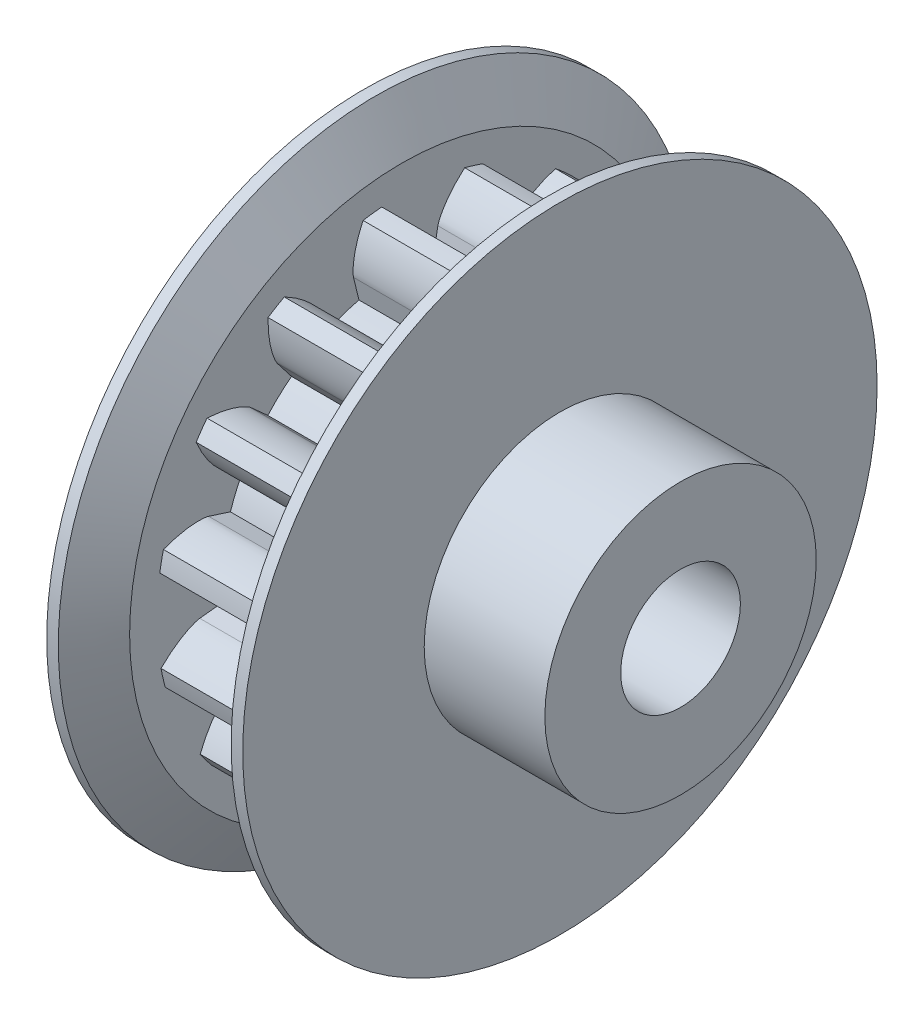
from build123d import *

# Parameters (mm, degrees)
SKETCH1_R                 = 8.116902098
BOSS_EXTRUDE1_DEPTH       = 4
CUT_EXTRUDE1_DEPTH        = 13.155994378
CIRPATTERN6_COUNT         = 15
CIRPATTERN6_COPY_1_DEPTH  = 13.155994378
CIRPATTERN6_COPY_2_DEPTH  = 13.155994378
CIRPATTERN6_COPY_3_DEPTH  = 13.155994378
CIRPATTERN6_COPY_4_DEPTH  = 13.155994378
CIRPATTERN6_COPY_5_DEPTH  = 13.155994378
CIRPATTERN6_COPY_6_DEPTH  = 13.155994378
CIRPATTERN6_COPY_7_DEPTH  = 13.155994378
CIRPATTERN6_COPY_8_DEPTH  = 13.155994378
CIRPATTERN6_COPY_9_DEPTH  = 13.155994378
CIRPATTERN6_COPY_10_DEPTH = 13.155994378
CIRPATTERN6_COPY_11_DEPTH = 13.155994378
CIRPATTERN6_COPY_12_DEPTH = 13.155994378
CIRPATTERN6_COPY_13_DEPTH = 13.155994378
CIRPATTERN6_COPY_14_DEPTH = 13.155994378
SKETCH5_R                 = 4.5
BOSS_EXTRUDE2_DEPTH       = 4
SKETCH6_R                 = 1.984375
CUT_EXTRUDE2_DEPTH        = 19.207820136


with BuildPart() as part:
    # Sketch1 → Boss-Extrude1 (new body)
    with BuildSketch(Plane.YZ):
        with Locations(Location((0, 0, 0), (0, 0, 270))):
            Circle(SKETCH1_R)
    extrude(amount=BOSS_EXTRUDE1_DEPTH)

    # Sketch3 → Cut-Extrude1 (cut, through all)
    with BuildSketch(Plane.YZ.offset(4)):
        with BuildLine():
            Line((7.133104785, -0.642390333), (6.70292593, -0.603649456))
            Line((6.70292593, -0.603649456), (5.944253988, -0.535325278))
            ThreePointArc((5.944253988, -0.535325278), (5.962293238, -0.267932763), (5.968310366, 0))
            Line((5.968310366, 0), (6.730052651, 0))
            add(Edge.make_bspline(
                [(6.730052651, 0), (6.735028201, 0.000105291), (6.748972525, 0.000726446), (6.77527671, 0.003186858), (6.818021267, 0.009021853), (6.872154257, 0.019121147), (6.9416096, 0.03521433), (7.022648863, 0.058053596), (7.110734403, 0.087182224), (7.205358415, 0.123170438), (7.298569457, 0.162835205), (7.390333265, 0.205857711), (7.480573489, 0.251804665), (7.588384326, 0.311053922), (7.715499791, 0.387065097), (7.860631857, 0.482971281), (8.020934099, 0.599954491), (8.179305123, 0.727671007), (8.330895439, 0.860239842), (8.478803786, 1.001795462), (8.618157696, 1.144139991), (8.757082001, 1.299382167), (8.88238288, 1.446480246), (9.015933814, 1.619048793), (9.121746557, 1.760623063), (9.225109986, 1.913051571), (9.274529275, 1.988136308), (9.299406998, 2.026881066)],
                knots=[0, 0, 0, 0, 0, 0.005376748, 0.015083688, 0.02853182, 0.046610139, 0.064854849, 0.092110525, 0.119476175, 0.146842495, 0.174208853, 0.201574955, 0.228941013, 0.256307345, 0.307035032, 0.361767351, 0.41649966, 0.471231936, 0.525964281, 0.580696615, 0.635428982, 0.690161387, 0.744893688, 0.799626083, 0.854358408, 0.909090916, 0.909090916, 0.909090916, 0.909090916, 0.909090916], degree=4))
            Line((9.299406998, 2.026881066), (9.299406998, -0.837482322))
            Line((9.299406998, -0.837482322), (7.133104785, -0.642390333))
        make_face()
    cut_extrude1 = extrude(amount=-CUT_EXTRUDE1_DEPTH, mode=Mode.SUBTRACT)

    # Mirror1: Cut-Extrude1 across plane
    add(cut_extrude1.mirror(Plane(origin=(0, 7.133104785, -0.642390333), x_dir=(1, 0, 0), z_dir=(0, -0.08969461116093967, -0.9959693151541809))), mode=Mode.SUBTRACT)

    # CirPattern6: Cut-Extrude1 ×15 about axis
    cirpattern6_axis = Axis((4, 0, 0), (-1, 0, 0))
    for i in range(1, CIRPATTERN6_COUNT):
        add(cut_extrude1.rotate(cirpattern6_axis, i * 360 / CIRPATTERN6_COUNT), mode=Mode.SUBTRACT)

    # CirPattern6 copy 1 sketch → CirPattern6 copy 1 (cut, through all)
    with BuildSketch(Plane(origin=(4, 0, 0), x_dir=(0, 0.8261762114847315, -0.5634118099372218), z_dir=(1, 0, 0))):
        with BuildLine():
            Line((7.133104785, 0.642390333), (6.70292593, 0.603649456))
            Line((6.70292593, 0.603649456), (5.944253988, 0.535325278))
            ThreePointArc((5.944253988, 0.535325278), (5.962293238, 0.267932763), (5.968310366, 0))
            Line((5.968310366, 0), (6.730052651, 0))
            add(Edge.make_bspline(
                [(6.730052651, 0), (6.735028201, -0.000105291), (6.748972525, -0.000726446), (6.77527671, -0.003186858), (6.818021267, -0.009021853), (6.872154257, -0.019121147), (6.9416096, -0.03521433), (7.022648863, -0.058053596), (7.110734403, -0.087182224), (7.205358415, -0.123170438), (7.298569457, -0.162835205), (7.390333265, -0.205857711), (7.480573489, -0.251804665), (7.588384326, -0.311053922), (7.715499791, -0.387065097), (7.860631857, -0.482971281), (8.020934099, -0.599954491), (8.179305123, -0.727671007), (8.330895439, -0.860239842), (8.478803786, -1.001795462), (8.618157696, -1.144139991), (8.757082001, -1.299382167), (8.88238288, -1.446480246), (9.015933814, -1.619048793), (9.121746557, -1.760623063), (9.225109986, -1.913051571), (9.274529275, -1.988136308), (9.299406998, -2.026881066)],
                knots=[0, 0, 0, 0, 0, 0.005376748, 0.015083688, 0.02853182, 0.046610139, 0.064854849, 0.092110525, 0.119476175, 0.146842495, 0.174208853, 0.201574955, 0.228941013, 0.256307345, 0.307035032, 0.361767351, 0.41649966, 0.471231936, 0.525964281, 0.580696615, 0.635428982, 0.690161387, 0.744893688, 0.799626083, 0.854358408, 0.909090916, 0.909090916, 0.909090916, 0.909090916, 0.909090916], degree=4))
            Line((9.299406998, -2.026881066), (9.299406998, 0.837482322))
            Line((9.299406998, 0.837482322), (7.133104785, 0.642390333))
        make_face()
    extrude(amount=-CIRPATTERN6_COPY_1_DEPTH, mode=Mode.SUBTRACT)

    # CirPattern6 copy 2 sketch → CirPattern6 copy 2 (cut, through all)
    with BuildSketch(Plane(origin=(4, 0, 0), x_dir=(0, 0.5255892969711229, -0.8507384385987274), z_dir=(1, 0, 0))):
        with BuildLine():
            Line((7.133104785, 0.642390333), (6.70292593, 0.603649456))
            Line((6.70292593, 0.603649456), (5.944253988, 0.535325278))
            ThreePointArc((5.944253988, 0.535325278), (5.962293238, 0.267932763), (5.968310366, 0))
            Line((5.968310366, 0), (6.730052651, 0))
            add(Edge.make_bspline(
                [(6.730052651, 0), (6.735028201, -0.000105291), (6.748972525, -0.000726446), (6.77527671, -0.003186858), (6.818021267, -0.009021853), (6.872154257, -0.019121147), (6.9416096, -0.03521433), (7.022648863, -0.058053596), (7.110734403, -0.087182224), (7.205358415, -0.123170438), (7.298569457, -0.162835205), (7.390333265, -0.205857711), (7.480573489, -0.251804665), (7.588384326, -0.311053922), (7.715499791, -0.387065097), (7.860631857, -0.482971281), (8.020934099, -0.599954491), (8.179305123, -0.727671007), (8.330895439, -0.860239842), (8.478803786, -1.001795462), (8.618157696, -1.144139991), (8.757082001, -1.299382167), (8.88238288, -1.446480246), (9.015933814, -1.619048793), (9.121746557, -1.760623063), (9.225109986, -1.913051571), (9.274529275, -1.988136308), (9.299406998, -2.026881066)],
                knots=[0, 0, 0, 0, 0, 0.005376748, 0.015083688, 0.02853182, 0.046610139, 0.064854849, 0.092110525, 0.119476175, 0.146842495, 0.174208853, 0.201574955, 0.228941013, 0.256307345, 0.307035032, 0.361767351, 0.41649966, 0.471231936, 0.525964281, 0.580696615, 0.635428982, 0.690161387, 0.744893688, 0.799626083, 0.854358408, 0.909090916, 0.909090916, 0.909090916, 0.909090916, 0.909090916], degree=4))
            Line((9.299406998, -2.026881066), (9.299406998, 0.837482322))
            Line((9.299406998, 0.837482322), (7.133104785, 0.642390333))
        make_face()
    extrude(amount=-CIRPATTERN6_COPY_2_DEPTH, mode=Mode.SUBTRACT)

    # CirPattern6 copy 3 sketch → CirPattern6 copy 3 (cut, through all)
    with BuildSketch(Plane(origin=(4, 0, 0), x_dir=(0, 0.1341232181823432, -0.9909646625104305), z_dir=(1, 0, 0))):
        with BuildLine():
            Line((7.133104785, 0.642390333), (6.70292593, 0.603649456))
            Line((6.70292593, 0.603649456), (5.944253988, 0.535325278))
            ThreePointArc((5.944253988, 0.535325278), (5.962293238, 0.267932763), (5.968310366, 0))
            Line((5.968310366, 0), (6.730052651, 0))
            add(Edge.make_bspline(
                [(6.730052651, 0), (6.735028201, -0.000105291), (6.748972525, -0.000726446), (6.77527671, -0.003186858), (6.818021267, -0.009021853), (6.872154257, -0.019121147), (6.9416096, -0.03521433), (7.022648863, -0.058053596), (7.110734403, -0.087182224), (7.205358415, -0.123170438), (7.298569457, -0.162835205), (7.390333265, -0.205857711), (7.480573489, -0.251804665), (7.588384326, -0.311053922), (7.715499791, -0.387065097), (7.860631857, -0.482971281), (8.020934099, -0.599954491), (8.179305123, -0.727671007), (8.330895439, -0.860239842), (8.478803786, -1.001795462), (8.618157696, -1.144139991), (8.757082001, -1.299382167), (8.88238288, -1.446480246), (9.015933814, -1.619048793), (9.121746557, -1.760623063), (9.225109986, -1.913051571), (9.274529275, -1.988136308), (9.299406998, -2.026881066)],
                knots=[0, 0, 0, 0, 0, 0.005376748, 0.015083688, 0.02853182, 0.046610139, 0.064854849, 0.092110525, 0.119476175, 0.146842495, 0.174208853, 0.201574955, 0.228941013, 0.256307345, 0.307035032, 0.361767351, 0.41649966, 0.471231936, 0.525964281, 0.580696615, 0.635428982, 0.690161387, 0.744893688, 0.799626083, 0.854358408, 0.909090916, 0.909090916, 0.909090916, 0.909090916, 0.909090916], degree=4))
            Line((9.299406998, -2.026881066), (9.299406998, 0.837482322))
            Line((9.299406998, 0.837482322), (7.133104785, 0.642390333))
        make_face()
    extrude(amount=-CIRPATTERN6_COPY_3_DEPTH, mode=Mode.SUBTRACT)

    # CirPattern6 copy 4 sketch → CirPattern6 copy 4 (cut, through all)
    with BuildSketch(Plane(origin=(4, 0, 0), x_dir=(0, -0.2805339835013487, -0.9598440936427461), z_dir=(1, 0, 0))):
        with BuildLine():
            Line((7.133104785, 0.642390333), (6.70292593, 0.603649456))
            Line((6.70292593, 0.603649456), (5.944253988, 0.535325278))
            ThreePointArc((5.944253988, 0.535325278), (5.962293238, 0.267932763), (5.968310366, 0))
            Line((5.968310366, 0), (6.730052651, 0))
            add(Edge.make_bspline(
                [(6.730052651, 0), (6.735028201, -0.000105291), (6.748972525, -0.000726446), (6.77527671, -0.003186858), (6.818021267, -0.009021853), (6.872154257, -0.019121147), (6.9416096, -0.03521433), (7.022648863, -0.058053596), (7.110734403, -0.087182224), (7.205358415, -0.123170438), (7.298569457, -0.162835205), (7.390333265, -0.205857711), (7.480573489, -0.251804665), (7.588384326, -0.311053922), (7.715499791, -0.387065097), (7.860631857, -0.482971281), (8.020934099, -0.599954491), (8.179305123, -0.727671007), (8.330895439, -0.860239842), (8.478803786, -1.001795462), (8.618157696, -1.144139991), (8.757082001, -1.299382167), (8.88238288, -1.446480246), (9.015933814, -1.619048793), (9.121746557, -1.760623063), (9.225109986, -1.913051571), (9.274529275, -1.988136308), (9.299406998, -2.026881066)],
                knots=[0, 0, 0, 0, 0, 0.005376748, 0.015083688, 0.02853182, 0.046610139, 0.064854849, 0.092110525, 0.119476175, 0.146842495, 0.174208853, 0.201574955, 0.228941013, 0.256307345, 0.307035032, 0.361767351, 0.41649966, 0.471231936, 0.525964281, 0.580696615, 0.635428982, 0.690161387, 0.744893688, 0.799626083, 0.854358408, 0.909090916, 0.909090916, 0.909090916, 0.909090916, 0.909090916], degree=4))
            Line((9.299406998, -2.026881066), (9.299406998, 0.837482322))
            Line((9.299406998, 0.837482322), (7.133104785, 0.642390333))
        make_face()
    extrude(amount=-CIRPATTERN6_COPY_4_DEPTH, mode=Mode.SUBTRACT)

    # CirPattern6 copy 5 sketch → CirPattern6 copy 5 (cut, through all)
    with BuildSketch(Plane(origin=(4, 0, 0), x_dir=(0, -0.6466843108664259, -0.7627577610743896), z_dir=(1, 0, 0))):
        with BuildLine():
            Line((7.133104785, 0.642390333), (6.70292593, 0.603649456))
            Line((6.70292593, 0.603649456), (5.944253988, 0.535325278))
            ThreePointArc((5.944253988, 0.535325278), (5.962293238, 0.267932763), (5.968310366, 0))
            Line((5.968310366, 0), (6.730052651, 0))
            add(Edge.make_bspline(
                [(6.730052651, 0), (6.735028201, -0.000105291), (6.748972525, -0.000726446), (6.77527671, -0.003186858), (6.818021267, -0.009021853), (6.872154257, -0.019121147), (6.9416096, -0.03521433), (7.022648863, -0.058053596), (7.110734403, -0.087182224), (7.205358415, -0.123170438), (7.298569457, -0.162835205), (7.390333265, -0.205857711), (7.480573489, -0.251804665), (7.588384326, -0.311053922), (7.715499791, -0.387065097), (7.860631857, -0.482971281), (8.020934099, -0.599954491), (8.179305123, -0.727671007), (8.330895439, -0.860239842), (8.478803786, -1.001795462), (8.618157696, -1.144139991), (8.757082001, -1.299382167), (8.88238288, -1.446480246), (9.015933814, -1.619048793), (9.121746557, -1.760623063), (9.225109986, -1.913051571), (9.274529275, -1.988136308), (9.299406998, -2.026881066)],
                knots=[0, 0, 0, 0, 0, 0.005376748, 0.015083688, 0.02853182, 0.046610139, 0.064854849, 0.092110525, 0.119476175, 0.146842495, 0.174208853, 0.201574955, 0.228941013, 0.256307345, 0.307035032, 0.361767351, 0.41649966, 0.471231936, 0.525964281, 0.580696615, 0.635428982, 0.690161387, 0.744893688, 0.799626083, 0.854358408, 0.909090916, 0.909090916, 0.909090916, 0.909090916, 0.909090916], degree=4))
            Line((9.299406998, -2.026881066), (9.299406998, 0.837482322))
            Line((9.299406998, 0.837482322), (7.133104785, 0.642390333))
        make_face()
    extrude(amount=-CIRPATTERN6_COPY_5_DEPTH, mode=Mode.SUBTRACT)

    # CirPattern6 copy 6 sketch → CirPattern6 copy 6 (cut, through all)
    with BuildSketch(Plane(origin=(4, 0, 0), x_dir=(0, -0.9010170459401696, -0.43378368217955166), z_dir=(1, 0, 0))):
        with BuildLine():
            Line((7.133104785, 0.642390333), (6.70292593, 0.603649456))
            Line((6.70292593, 0.603649456), (5.944253988, 0.535325278))
            ThreePointArc((5.944253988, 0.535325278), (5.962293238, 0.267932763), (5.968310366, 0))
            Line((5.968310366, 0), (6.730052651, 0))
            add(Edge.make_bspline(
                [(6.730052651, 0), (6.735028201, -0.000105291), (6.748972525, -0.000726446), (6.77527671, -0.003186858), (6.818021267, -0.009021853), (6.872154257, -0.019121147), (6.9416096, -0.03521433), (7.022648863, -0.058053596), (7.110734403, -0.087182224), (7.205358415, -0.123170438), (7.298569457, -0.162835205), (7.390333265, -0.205857711), (7.480573489, -0.251804665), (7.588384326, -0.311053922), (7.715499791, -0.387065097), (7.860631857, -0.482971281), (8.020934099, -0.599954491), (8.179305123, -0.727671007), (8.330895439, -0.860239842), (8.478803786, -1.001795462), (8.618157696, -1.144139991), (8.757082001, -1.299382167), (8.88238288, -1.446480246), (9.015933814, -1.619048793), (9.121746557, -1.760623063), (9.225109986, -1.913051571), (9.274529275, -1.988136308), (9.299406998, -2.026881066)],
                knots=[0, 0, 0, 0, 0, 0.005376748, 0.015083688, 0.02853182, 0.046610139, 0.064854849, 0.092110525, 0.119476175, 0.146842495, 0.174208853, 0.201574955, 0.228941013, 0.256307345, 0.307035032, 0.361767351, 0.41649966, 0.471231936, 0.525964281, 0.580696615, 0.635428982, 0.690161387, 0.744893688, 0.799626083, 0.854358408, 0.909090916, 0.909090916, 0.909090916, 0.909090916, 0.909090916], degree=4))
            Line((9.299406998, -2.026881066), (9.299406998, 0.837482322))
            Line((9.299406998, 0.837482322), (7.133104785, 0.642390333))
        make_face()
    extrude(amount=-CIRPATTERN6_COPY_6_DEPTH, mode=Mode.SUBTRACT)

    # CirPattern6 copy 7 sketch → CirPattern6 copy 7 (cut, through all)
    with BuildSketch(Plane(origin=(4, 0, 0), x_dir=(0, -0.9995557482879672, -0.029804463834832234), z_dir=(1, 0, 0))):
        with BuildLine():
            Line((7.133104785, 0.642390333), (6.70292593, 0.603649456))
            Line((6.70292593, 0.603649456), (5.944253988, 0.535325278))
            ThreePointArc((5.944253988, 0.535325278), (5.962293238, 0.267932763), (5.968310366, 0))
            Line((5.968310366, 0), (6.730052651, 0))
            add(Edge.make_bspline(
                [(6.730052651, 0), (6.735028201, -0.000105291), (6.748972525, -0.000726446), (6.77527671, -0.003186858), (6.818021267, -0.009021853), (6.872154257, -0.019121147), (6.9416096, -0.03521433), (7.022648863, -0.058053596), (7.110734403, -0.087182224), (7.205358415, -0.123170438), (7.298569457, -0.162835205), (7.390333265, -0.205857711), (7.480573489, -0.251804665), (7.588384326, -0.311053922), (7.715499791, -0.387065097), (7.860631857, -0.482971281), (8.020934099, -0.599954491), (8.179305123, -0.727671007), (8.330895439, -0.860239842), (8.478803786, -1.001795462), (8.618157696, -1.144139991), (8.757082001, -1.299382167), (8.88238288, -1.446480246), (9.015933814, -1.619048793), (9.121746557, -1.760623063), (9.225109986, -1.913051571), (9.274529275, -1.988136308), (9.299406998, -2.026881066)],
                knots=[0, 0, 0, 0, 0, 0.005376748, 0.015083688, 0.02853182, 0.046610139, 0.064854849, 0.092110525, 0.119476175, 0.146842495, 0.174208853, 0.201574955, 0.228941013, 0.256307345, 0.307035032, 0.361767351, 0.41649966, 0.471231936, 0.525964281, 0.580696615, 0.635428982, 0.690161387, 0.744893688, 0.799626083, 0.854358408, 0.909090916, 0.909090916, 0.909090916, 0.909090916, 0.909090916], degree=4))
            Line((9.299406998, -2.026881066), (9.299406998, 0.837482322))
            Line((9.299406998, 0.837482322), (7.133104785, 0.642390333))
        make_face()
    extrude(amount=-CIRPATTERN6_COPY_7_DEPTH, mode=Mode.SUBTRACT)

    # CirPattern6 copy 8 sketch → CirPattern6 copy 8 (cut, through all)
    with BuildSketch(Plane(origin=(4, 0, 0), x_dir=(0, -0.925262181077877, 0.3793282170719833), z_dir=(1, 0, 0))):
        with BuildLine():
            Line((7.133104785, 0.642390333), (6.70292593, 0.603649456))
            Line((6.70292593, 0.603649456), (5.944253988, 0.535325278))
            ThreePointArc((5.944253988, 0.535325278), (5.962293238, 0.267932763), (5.968310366, 0))
            Line((5.968310366, 0), (6.730052651, 0))
            add(Edge.make_bspline(
                [(6.730052651, 0), (6.735028201, -0.000105291), (6.748972525, -0.000726446), (6.77527671, -0.003186858), (6.818021267, -0.009021853), (6.872154257, -0.019121147), (6.9416096, -0.03521433), (7.022648863, -0.058053596), (7.110734403, -0.087182224), (7.205358415, -0.123170438), (7.298569457, -0.162835205), (7.390333265, -0.205857711), (7.480573489, -0.251804665), (7.588384326, -0.311053922), (7.715499791, -0.387065097), (7.860631857, -0.482971281), (8.020934099, -0.599954491), (8.179305123, -0.727671007), (8.330895439, -0.860239842), (8.478803786, -1.001795462), (8.618157696, -1.144139991), (8.757082001, -1.299382167), (8.88238288, -1.446480246), (9.015933814, -1.619048793), (9.121746557, -1.760623063), (9.225109986, -1.913051571), (9.274529275, -1.988136308), (9.299406998, -2.026881066)],
                knots=[0, 0, 0, 0, 0, 0.005376748, 0.015083688, 0.02853182, 0.046610139, 0.064854849, 0.092110525, 0.119476175, 0.146842495, 0.174208853, 0.201574955, 0.228941013, 0.256307345, 0.307035032, 0.361767351, 0.41649966, 0.471231936, 0.525964281, 0.580696615, 0.635428982, 0.690161387, 0.744893688, 0.799626083, 0.854358408, 0.909090916, 0.909090916, 0.909090916, 0.909090916, 0.909090916], degree=4))
            Line((9.299406998, -2.026881066), (9.299406998, 0.837482322))
            Line((9.299406998, 0.837482322), (7.133104785, 0.642390333))
        make_face()
    extrude(amount=-CIRPATTERN6_COPY_8_DEPTH, mode=Mode.SUBTRACT)

    # CirPattern6 copy 9 sketch → CirPattern6 copy 9 (cut, through all)
    with BuildSketch(Plane(origin=(4, 0, 0), x_dir=(0, -0.6909823770163936, 0.7228716031583856), z_dir=(1, 0, 0))):
        with BuildLine():
            Line((7.133104785, 0.642390333), (6.70292593, 0.603649456))
            Line((6.70292593, 0.603649456), (5.944253988, 0.535325278))
            ThreePointArc((5.944253988, 0.535325278), (5.962293238, 0.267932763), (5.968310366, 0))
            Line((5.968310366, 0), (6.730052651, 0))
            add(Edge.make_bspline(
                [(6.730052651, 0), (6.735028201, -0.000105291), (6.748972525, -0.000726446), (6.77527671, -0.003186858), (6.818021267, -0.009021853), (6.872154257, -0.019121147), (6.9416096, -0.03521433), (7.022648863, -0.058053596), (7.110734403, -0.087182224), (7.205358415, -0.123170438), (7.298569457, -0.162835205), (7.390333265, -0.205857711), (7.480573489, -0.251804665), (7.588384326, -0.311053922), (7.715499791, -0.387065097), (7.860631857, -0.482971281), (8.020934099, -0.599954491), (8.179305123, -0.727671007), (8.330895439, -0.860239842), (8.478803786, -1.001795462), (8.618157696, -1.144139991), (8.757082001, -1.299382167), (8.88238288, -1.446480246), (9.015933814, -1.619048793), (9.121746557, -1.760623063), (9.225109986, -1.913051571), (9.274529275, -1.988136308), (9.299406998, -2.026881066)],
                knots=[0, 0, 0, 0, 0, 0.005376748, 0.015083688, 0.02853182, 0.046610139, 0.064854849, 0.092110525, 0.119476175, 0.146842495, 0.174208853, 0.201574955, 0.228941013, 0.256307345, 0.307035032, 0.361767351, 0.41649966, 0.471231936, 0.525964281, 0.580696615, 0.635428982, 0.690161387, 0.744893688, 0.799626083, 0.854358408, 0.909090916, 0.909090916, 0.909090916, 0.909090916, 0.909090916], degree=4))
            Line((9.299406998, -2.026881066), (9.299406998, 0.837482322))
            Line((9.299406998, 0.837482322), (7.133104785, 0.642390333))
        make_face()
    extrude(amount=-CIRPATTERN6_COPY_9_DEPTH, mode=Mode.SUBTRACT)

    # CirPattern6 copy 10 sketch → CirPattern6 copy 10 (cut, through all)
    with BuildSketch(Plane(origin=(4, 0, 0), x_dir=(0, -0.3372254425909501, 0.9414239219763527), z_dir=(1, 0, 0))):
        with BuildLine():
            Line((7.133104785, 0.642390333), (6.70292593, 0.603649456))
            Line((6.70292593, 0.603649456), (5.944253988, 0.535325278))
            ThreePointArc((5.944253988, 0.535325278), (5.962293238, 0.267932763), (5.968310366, 0))
            Line((5.968310366, 0), (6.730052651, 0))
            add(Edge.make_bspline(
                [(6.730052651, 0), (6.735028201, -0.000105291), (6.748972525, -0.000726446), (6.77527671, -0.003186858), (6.818021267, -0.009021853), (6.872154257, -0.019121147), (6.9416096, -0.03521433), (7.022648863, -0.058053596), (7.110734403, -0.087182224), (7.205358415, -0.123170438), (7.298569457, -0.162835205), (7.390333265, -0.205857711), (7.480573489, -0.251804665), (7.588384326, -0.311053922), (7.715499791, -0.387065097), (7.860631857, -0.482971281), (8.020934099, -0.599954491), (8.179305123, -0.727671007), (8.330895439, -0.860239842), (8.478803786, -1.001795462), (8.618157696, -1.144139991), (8.757082001, -1.299382167), (8.88238288, -1.446480246), (9.015933814, -1.619048793), (9.121746557, -1.760623063), (9.225109986, -1.913051571), (9.274529275, -1.988136308), (9.299406998, -2.026881066)],
                knots=[0, 0, 0, 0, 0, 0.005376748, 0.015083688, 0.02853182, 0.046610139, 0.064854849, 0.092110525, 0.119476175, 0.146842495, 0.174208853, 0.201574955, 0.228941013, 0.256307345, 0.307035032, 0.361767351, 0.41649966, 0.471231936, 0.525964281, 0.580696615, 0.635428982, 0.690161387, 0.744893688, 0.799626083, 0.854358408, 0.909090916, 0.909090916, 0.909090916, 0.909090916, 0.909090916], degree=4))
            Line((9.299406998, -2.026881066), (9.299406998, 0.837482322))
            Line((9.299406998, 0.837482322), (7.133104785, 0.642390333))
        make_face()
    extrude(amount=-CIRPATTERN6_COPY_10_DEPTH, mode=Mode.SUBTRACT)

    # CirPattern6 copy 11 sketch → CirPattern6 copy 11 (cut, through all)
    with BuildSketch(Plane(origin=(4, 0, 0), x_dir=(0, 0.07484083445543825, 0.9971954921167733), z_dir=(1, 0, 0))):
        with BuildLine():
            Line((7.133104785, 0.642390333), (6.70292593, 0.603649456))
            Line((6.70292593, 0.603649456), (5.944253988, 0.535325278))
            ThreePointArc((5.944253988, 0.535325278), (5.962293238, 0.267932763), (5.968310366, 0))
            Line((5.968310366, 0), (6.730052651, 0))
            add(Edge.make_bspline(
                [(6.730052651, 0), (6.735028201, -0.000105291), (6.748972525, -0.000726446), (6.77527671, -0.003186858), (6.818021267, -0.009021853), (6.872154257, -0.019121147), (6.9416096, -0.03521433), (7.022648863, -0.058053596), (7.110734403, -0.087182224), (7.205358415, -0.123170438), (7.298569457, -0.162835205), (7.390333265, -0.205857711), (7.480573489, -0.251804665), (7.588384326, -0.311053922), (7.715499791, -0.387065097), (7.860631857, -0.482971281), (8.020934099, -0.599954491), (8.179305123, -0.727671007), (8.330895439, -0.860239842), (8.478803786, -1.001795462), (8.618157696, -1.144139991), (8.757082001, -1.299382167), (8.88238288, -1.446480246), (9.015933814, -1.619048793), (9.121746557, -1.760623063), (9.225109986, -1.913051571), (9.274529275, -1.988136308), (9.299406998, -2.026881066)],
                knots=[0, 0, 0, 0, 0, 0.005376748, 0.015083688, 0.02853182, 0.046610139, 0.064854849, 0.092110525, 0.119476175, 0.146842495, 0.174208853, 0.201574955, 0.228941013, 0.256307345, 0.307035032, 0.361767351, 0.41649966, 0.471231936, 0.525964281, 0.580696615, 0.635428982, 0.690161387, 0.744893688, 0.799626083, 0.854358408, 0.909090916, 0.909090916, 0.909090916, 0.909090916, 0.909090916], degree=4))
            Line((9.299406998, -2.026881066), (9.299406998, 0.837482322))
            Line((9.299406998, 0.837482322), (7.133104785, 0.642390333))
        make_face()
    extrude(amount=-CIRPATTERN6_COPY_11_DEPTH, mode=Mode.SUBTRACT)

    # CirPattern6 copy 12 sketch → CirPattern6 copy 12 (cut, through all)
    with BuildSketch(Plane(origin=(4, 0, 0), x_dir=(0, 0.4739664513168441, 0.8805429024335597), z_dir=(1, 0, 0))):
        with BuildLine():
            Line((7.133104785, 0.642390333), (6.70292593, 0.603649456))
            Line((6.70292593, 0.603649456), (5.944253988, 0.535325278))
            ThreePointArc((5.944253988, 0.535325278), (5.962293238, 0.267932763), (5.968310366, 0))
            Line((5.968310366, 0), (6.730052651, 0))
            add(Edge.make_bspline(
                [(6.730052651, 0), (6.735028201, -0.000105291), (6.748972525, -0.000726446), (6.77527671, -0.003186858), (6.818021267, -0.009021853), (6.872154257, -0.019121147), (6.9416096, -0.03521433), (7.022648863, -0.058053596), (7.110734403, -0.087182224), (7.205358415, -0.123170438), (7.298569457, -0.162835205), (7.390333265, -0.205857711), (7.480573489, -0.251804665), (7.588384326, -0.311053922), (7.715499791, -0.387065097), (7.860631857, -0.482971281), (8.020934099, -0.599954491), (8.179305123, -0.727671007), (8.330895439, -0.860239842), (8.478803786, -1.001795462), (8.618157696, -1.144139991), (8.757082001, -1.299382167), (8.88238288, -1.446480246), (9.015933814, -1.619048793), (9.121746557, -1.760623063), (9.225109986, -1.913051571), (9.274529275, -1.988136308), (9.299406998, -2.026881066)],
                knots=[0, 0, 0, 0, 0, 0.005376748, 0.015083688, 0.02853182, 0.046610139, 0.064854849, 0.092110525, 0.119476175, 0.146842495, 0.174208853, 0.201574955, 0.228941013, 0.256307345, 0.307035032, 0.361767351, 0.41649966, 0.471231936, 0.525964281, 0.580696615, 0.635428982, 0.690161387, 0.744893688, 0.799626083, 0.854358408, 0.909090916, 0.909090916, 0.909090916, 0.909090916, 0.909090916], degree=4))
            Line((9.299406998, -2.026881066), (9.299406998, 0.837482322))
            Line((9.299406998, 0.837482322), (7.133104785, 0.642390333))
        make_face()
    extrude(amount=-CIRPATTERN6_COPY_12_DEPTH, mode=Mode.SUBTRACT)

    # CirPattern6 copy 13 sketch → CirPattern6 copy 13 (cut, through all)
    with BuildSketch(Plane(origin=(4, 0, 0), x_dir=(0, 0.7911389628955336, 0.6116364454384479), z_dir=(1, 0, 0))):
        with BuildLine():
            Line((7.133104785, 0.642390333), (6.70292593, 0.603649456))
            Line((6.70292593, 0.603649456), (5.944253988, 0.535325278))
            ThreePointArc((5.944253988, 0.535325278), (5.962293238, 0.267932763), (5.968310366, 0))
            Line((5.968310366, 0), (6.730052651, 0))
            add(Edge.make_bspline(
                [(6.730052651, 0), (6.735028201, -0.000105291), (6.748972525, -0.000726446), (6.77527671, -0.003186858), (6.818021267, -0.009021853), (6.872154257, -0.019121147), (6.9416096, -0.03521433), (7.022648863, -0.058053596), (7.110734403, -0.087182224), (7.205358415, -0.123170438), (7.298569457, -0.162835205), (7.390333265, -0.205857711), (7.480573489, -0.251804665), (7.588384326, -0.311053922), (7.715499791, -0.387065097), (7.860631857, -0.482971281), (8.020934099, -0.599954491), (8.179305123, -0.727671007), (8.330895439, -0.860239842), (8.478803786, -1.001795462), (8.618157696, -1.144139991), (8.757082001, -1.299382167), (8.88238288, -1.446480246), (9.015933814, -1.619048793), (9.121746557, -1.760623063), (9.225109986, -1.913051571), (9.274529275, -1.988136308), (9.299406998, -2.026881066)],
                knots=[0, 0, 0, 0, 0, 0.005376748, 0.015083688, 0.02853182, 0.046610139, 0.064854849, 0.092110525, 0.119476175, 0.146842495, 0.174208853, 0.201574955, 0.228941013, 0.256307345, 0.307035032, 0.361767351, 0.41649966, 0.471231936, 0.525964281, 0.580696615, 0.635428982, 0.690161387, 0.744893688, 0.799626083, 0.854358408, 0.909090916, 0.909090916, 0.909090916, 0.909090916, 0.909090916], degree=4))
            Line((9.299406998, -2.026881066), (9.299406998, 0.837482322))
            Line((9.299406998, 0.837482322), (7.133104785, 0.642390333))
        make_face()
    extrude(amount=-CIRPATTERN6_COPY_13_DEPTH, mode=Mode.SUBTRACT)

    # CirPattern6 copy 14 sketch → CirPattern6 copy 14 (cut, through all)
    with BuildSketch(Plane(origin=(4, 0, 0), x_dir=(0, 0.9715163605177423, 0.2369724904843605), z_dir=(1, 0, 0))):
        with BuildLine():
            Line((7.133104785, 0.642390333), (6.70292593, 0.603649456))
            Line((6.70292593, 0.603649456), (5.944253988, 0.535325278))
            ThreePointArc((5.944253988, 0.535325278), (5.962293238, 0.267932763), (5.968310366, 0))
            Line((5.968310366, 0), (6.730052651, 0))
            add(Edge.make_bspline(
                [(6.730052651, 0), (6.735028201, -0.000105291), (6.748972525, -0.000726446), (6.77527671, -0.003186858), (6.818021267, -0.009021853), (6.872154257, -0.019121147), (6.9416096, -0.03521433), (7.022648863, -0.058053596), (7.110734403, -0.087182224), (7.205358415, -0.123170438), (7.298569457, -0.162835205), (7.390333265, -0.205857711), (7.480573489, -0.251804665), (7.588384326, -0.311053922), (7.715499791, -0.387065097), (7.860631857, -0.482971281), (8.020934099, -0.599954491), (8.179305123, -0.727671007), (8.330895439, -0.860239842), (8.478803786, -1.001795462), (8.618157696, -1.144139991), (8.757082001, -1.299382167), (8.88238288, -1.446480246), (9.015933814, -1.619048793), (9.121746557, -1.760623063), (9.225109986, -1.913051571), (9.274529275, -1.988136308), (9.299406998, -2.026881066)],
                knots=[0, 0, 0, 0, 0, 0.005376748, 0.015083688, 0.02853182, 0.046610139, 0.064854849, 0.092110525, 0.119476175, 0.146842495, 0.174208853, 0.201574955, 0.228941013, 0.256307345, 0.307035032, 0.361767351, 0.41649966, 0.471231936, 0.525964281, 0.580696615, 0.635428982, 0.690161387, 0.744893688, 0.799626083, 0.854358408, 0.909090916, 0.909090916, 0.909090916, 0.909090916, 0.909090916], degree=4))
            Line((9.299406998, -2.026881066), (9.299406998, 0.837482322))
            Line((9.299406998, 0.837482322), (7.133104785, 0.642390333))
        make_face()
    extrude(amount=-CIRPATTERN6_COPY_14_DEPTH, mode=Mode.SUBTRACT)

    # Sketch4 → Revolve1 (revolve)
    with BuildSketch(Plane(origin=(0, 0, 0), x_dir=(-1, 0, 0), z_dir=(0, 1, 0)), mode=Mode.PRIVATE) as revolve1_sk:
        Polygon((-4, 0), (-4, 9.018429401), (-4.866025404, 10.518429401), (-5.25, 10.518429401), (-5.25, 0), align=None)
        Polygon((0, 0), (1.25, 0), (1.25, 10.518429401), (0.866025404, 10.518429401), (0, 9.018429401), align=None)
    revolve(revolve1_sk.sketch.rotate(Axis((9.291003126, 0, 0), (-1, 0, 0)), 180), axis=Axis((9.291003126, 0, 0), (-1, 0, 0)))

    # Sketch5 → Boss-Extrude2 (add)
    with BuildSketch(Plane.YZ.offset(5.25)):
        with Locations(Location((0, 0, 0), (0, 0, 270))):
            Circle(SKETCH5_R)
    extrude(amount=BOSS_EXTRUDE2_DEPTH)

    # Sketch6 → Cut-Extrude2 (cut, through all)
    with BuildSketch(Plane.YZ.offset(9.25)):
        with Locations(Location((0, 0, 0), (0, 0, 270))):
            Circle(SKETCH6_R)
    extrude(amount=-CUT_EXTRUDE2_DEPTH, mode=Mode.SUBTRACT)


solid = part.part
